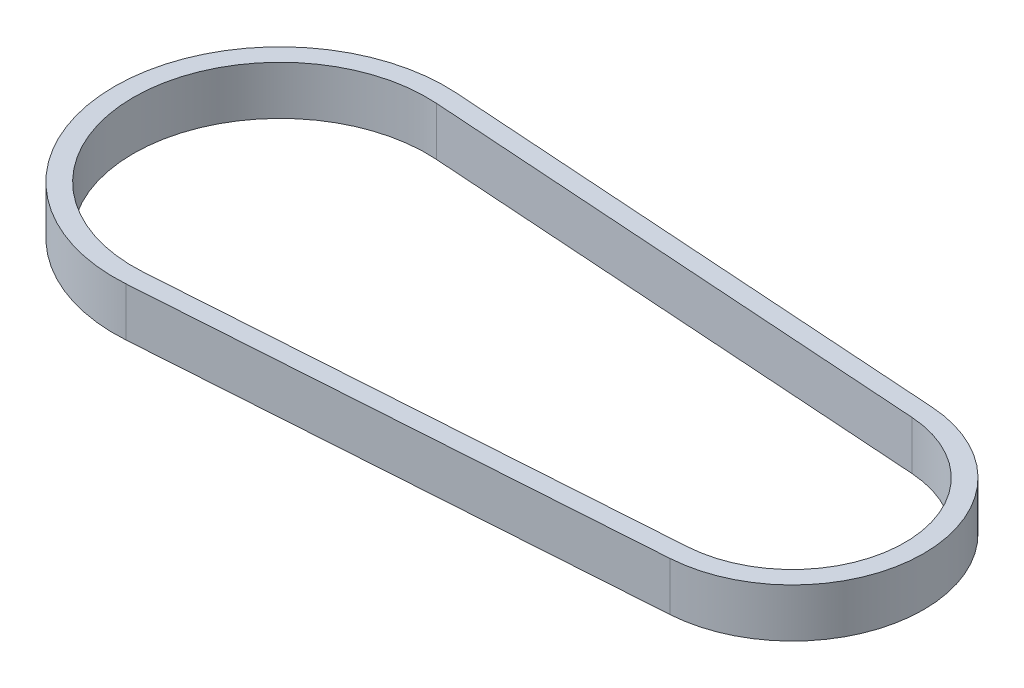
from build123d import *

# Parameters (mm, degrees)
BOSS_EXTRUDE1_DEPTH = 9


with BuildPart() as part:
    # Sketch1 → Boss-Extrude1 (new body)
    # profile 1 of 2: a face of its own
    with BuildSketch(Plane(origin=(0, 0, 0), x_dir=(1, 0, 0), z_dir=(0, 1, 0))):
        with BuildLine():
            Line((2.0530327, 30.58116343), (96.427689873, 24.24542484))
            ThreePointArc((96.427689873, 24.24542484), (119.1, 0), (96.427689873, -24.24542484))
            Line((96.427689873, -24.24542484), (2.0530327, -30.58116343))
            ThreePointArc((2.0530327, -30.58116343), (-30.65, 0), (2.0530327, 30.58116343))
        make_face()
        with BuildLine():
            ThreePointArc((96.293723629, -22.249916623), (117.1, 0), (96.293723629, 22.249916623))
            Line((96.293723629, 22.249916623), (1.919066456, 28.585655213))
            ThreePointArc((1.919066456, 28.585655213), (-28.65, 0), (1.919066456, -28.585655213))
            Line((1.919066456, -28.585655213), (96.293723629, -22.249916623))
        make_face(mode=Mode.SUBTRACT)
    # profile 2 of 2: a face of its own
    with BuildSketch(Plane(origin=(0, 0, 0), x_dir=(1, 0, 0), z_dir=(0, 1, 0))):
        with BuildLine():
            Line((1.919066456, -28.585655213), (96.293723629, -22.249916623))
            ThreePointArc((96.293723629, -22.249916623), (117.1, 0), (96.293723629, 22.249916623))
            Line((96.293723629, 22.249916623), (1.919066456, 28.585655213))
            ThreePointArc((1.919066456, 28.585655213), (-28.65, 0), (1.919066456, -28.585655213))
        make_face()
        with BuildLine():
            ThreePointArc((1.818591772, 27.08902405), (-27.15, 0), (1.818591772, -27.08902405))
            Line((1.818591772, -27.08902405), (96.193248945, -20.75328546))
            ThreePointArc((96.193248945, -20.75328546), (115.6, 0), (96.193248945, 20.75328546))
            Line((96.193248945, 20.75328546), (1.818591772, 27.08902405))
        make_face(mode=Mode.SUBTRACT)
    extrude(amount=BOSS_EXTRUDE1_DEPTH)


solid = part.part
